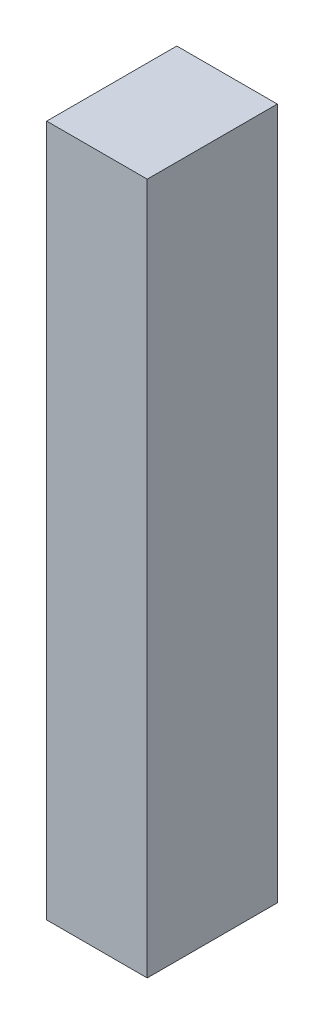
from build123d import *

# Parameters (mm, degrees)
SKETCH1_W           = 17
SKETCH1_H           = 22
BOSS_EXTRUDE1_DEPTH = 117


with BuildPart() as part:
    # Sketch1 → Boss-Extrude1 (new body)
    with BuildSketch(Plane(origin=(0, 0, 0), x_dir=(1, 0, 0), z_dir=(0, 1, 0))):
        with Locations((8.5, 11)):
            Rectangle(SKETCH1_W, SKETCH1_H)
    extrude(amount=BOSS_EXTRUDE1_DEPTH)


solid = part.part
